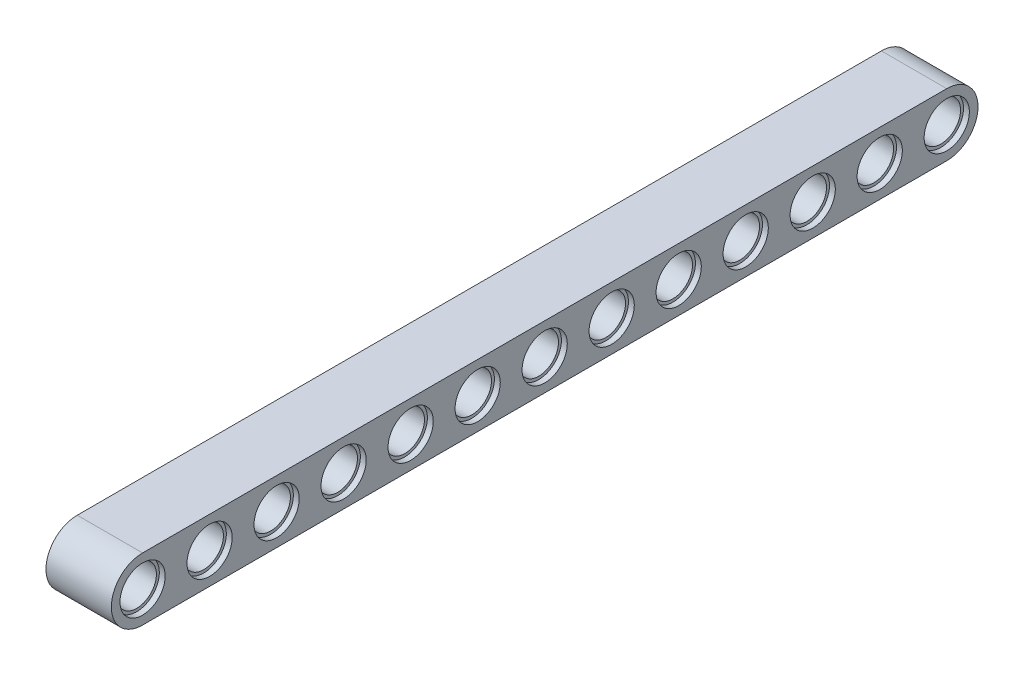
from build123d import *

# Parameters (mm, degrees)
SKETCH1_R           = 2.35
BOSS_EXTRUDE1_DEPTH = 7.8
SKETCH2_R           = 2.7
CUT_EXTRUDE1_DEPTH  = 0.7
SKETCH3_R           = 2.705
CUT_EXTRUDE2_DEPTH  = 0.7


with BuildPart() as part:
    # Sketch1 → Boss-Extrude1 (new body)
    with BuildSketch(Plane(origin=(0, 0, 0), x_dir=(0, 0, -1), z_dir=(1, 0, 0))):
        with BuildLine():
            Line((-48, -3.73), (48, -3.73))
            ThreePointArc((48, -3.73), (51.73, 0), (48, 3.73))
            Line((48, 3.73), (-48, 3.73))
            ThreePointArc((-48, 3.73), (-51.73, 0), (-48, -3.73))
        make_face()
        with Locations((-48, 0)):
            Circle(SKETCH1_R, mode=Mode.SUBTRACT)
        with Locations((-40, 0)):
            Circle(SKETCH1_R, mode=Mode.SUBTRACT)
        with Locations((-32, 0)):
            Circle(SKETCH1_R, mode=Mode.SUBTRACT)
        with Locations((-24, 0)):
            Circle(SKETCH1_R, mode=Mode.SUBTRACT)
        with Locations((-16, 0)):
            Circle(SKETCH1_R, mode=Mode.SUBTRACT)
        with Locations((-8, 0)):
            Circle(SKETCH1_R, mode=Mode.SUBTRACT)
        Circle(SKETCH1_R, mode=Mode.SUBTRACT)
        with Locations((8, 0)):
            Circle(SKETCH1_R, mode=Mode.SUBTRACT)
        with Locations((16, 0)):
            Circle(SKETCH1_R, mode=Mode.SUBTRACT)
        with Locations((24, 0)):
            Circle(SKETCH1_R, mode=Mode.SUBTRACT)
        with Locations((32, 0)):
            Circle(SKETCH1_R, mode=Mode.SUBTRACT)
        with Locations((40, 0)):
            Circle(SKETCH1_R, mode=Mode.SUBTRACT)
        with Locations((48, 0)):
            Circle(SKETCH1_R, mode=Mode.SUBTRACT)
    extrude(amount=BOSS_EXTRUDE1_DEPTH)

    # Sketch2 → Cut-Extrude1 (cut)
    with BuildSketch(Plane(origin=(7.8, 0, 0), x_dir=(0, 0, -1), z_dir=(1, 0, 0))):
        with Locations((-48, 0)):
            Circle(SKETCH2_R)
        with Locations((-40, 0)):
            Circle(SKETCH2_R)
        with Locations((-32, 0)):
            Circle(SKETCH2_R)
        with Locations((-24, 0)):
            Circle(SKETCH2_R)
        with Locations((-16, 0)):
            Circle(SKETCH2_R)
        with Locations((-8, 0)):
            Circle(SKETCH2_R)
        Circle(SKETCH2_R)
        with Locations((8, 0)):
            Circle(SKETCH2_R)
        with Locations((16, 0)):
            Circle(SKETCH2_R)
        with Locations((24, 0)):
            Circle(SKETCH2_R)
        with Locations((32, 0)):
            Circle(SKETCH2_R)
        with Locations((40, 0)):
            Circle(SKETCH2_R)
        with Locations((48, 0)):
            Circle(SKETCH2_R)
    extrude(amount=-CUT_EXTRUDE1_DEPTH, mode=Mode.SUBTRACT)

    # Sketch3 → Cut-Extrude2 (cut)
    with BuildSketch(Plane.ZY):
        with Locations((-48, 0)):
            Circle(SKETCH3_R)
        with Locations((-40, 0)):
            Circle(SKETCH3_R)
        with Locations((-32, 0)):
            Circle(SKETCH3_R)
        with Locations((-24, 0)):
            Circle(SKETCH3_R)
        with Locations((-16, 0)):
            Circle(SKETCH3_R)
        with Locations((-8, 0)):
            Circle(SKETCH3_R)
        Circle(SKETCH3_R)
        with Locations((8, 0)):
            Circle(SKETCH3_R)
        with Locations((16, 0)):
            Circle(SKETCH3_R)
        with Locations((24, 0)):
            Circle(SKETCH3_R)
        with Locations((32, 0)):
            Circle(SKETCH3_R)
        with Locations((40, 0)):
            Circle(SKETCH3_R)
        with Locations((48, 0)):
            Circle(SKETCH3_R)
    extrude(amount=-CUT_EXTRUDE2_DEPTH, mode=Mode.SUBTRACT)


solid = part.part
